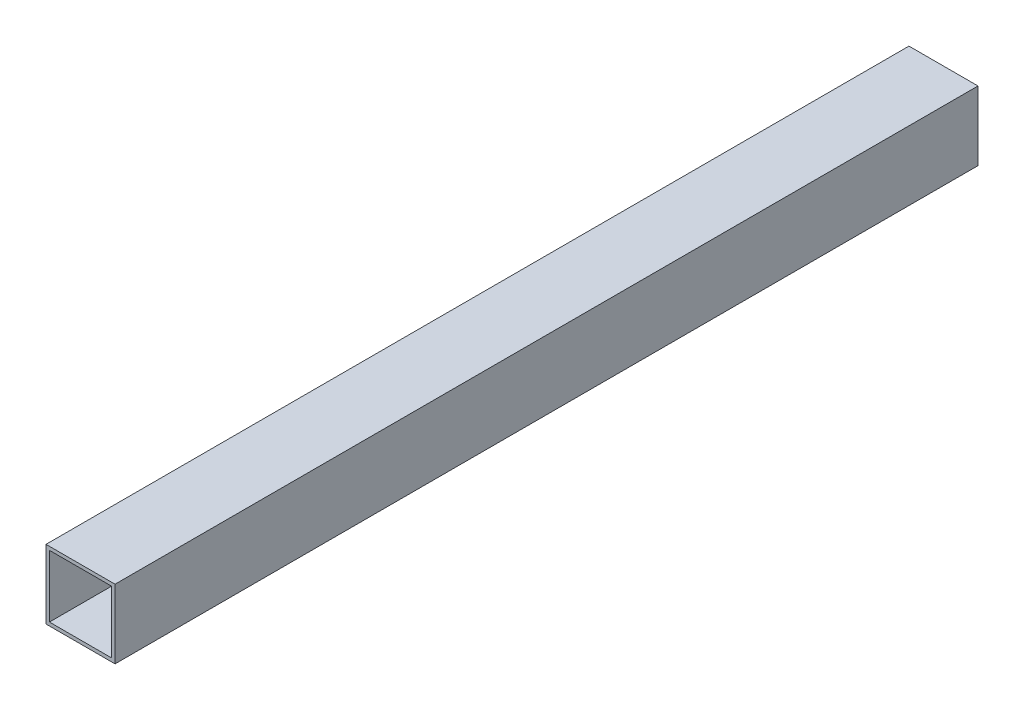
from build123d import *

# Parameters (mm, degrees)
CROQUIS1_W            = 40
CROQUIS1_H            = 40
CROQUIS1_W_2          = 36
CROQUIS1_H_2          = 36
EXTRUIR_L_MINA1_DEPTH = 500


with BuildPart() as part:
    # Croquis1 → Extruir-Lámina1 (new body)
    with BuildSketch(Plane.XY):
        Rectangle(CROQUIS1_W, CROQUIS1_H)
        Rectangle(CROQUIS1_W_2, CROQUIS1_H_2, mode=Mode.SUBTRACT)
    extrude(amount=EXTRUIR_L_MINA1_DEPTH)


solid = part.part
